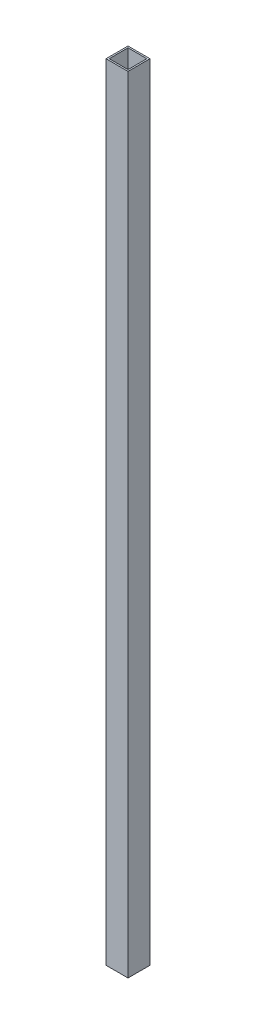
from build123d import *

# Parameters (mm, degrees)
SKETCH1_W           = 14
SKETCH1_H           = 14
SKETCH1_W_2         = 12
SKETCH1_H_2         = 12
BOSS_EXTRUDE1_DEPTH = 500


with BuildPart() as part:
    # Sketch1 → Boss-Extrude1 (new body)
    with BuildSketch(Plane(origin=(0, 0, 0), x_dir=(1, 0, 0), z_dir=(0, 1, 0))):
        with Locations((-7, -7)):
            Rectangle(SKETCH1_W, SKETCH1_H)
        with Locations((-7, -7)):
            Rectangle(SKETCH1_W_2, SKETCH1_H_2, mode=Mode.SUBTRACT)
    extrude(amount=BOSS_EXTRUDE1_DEPTH)


solid = part.part
